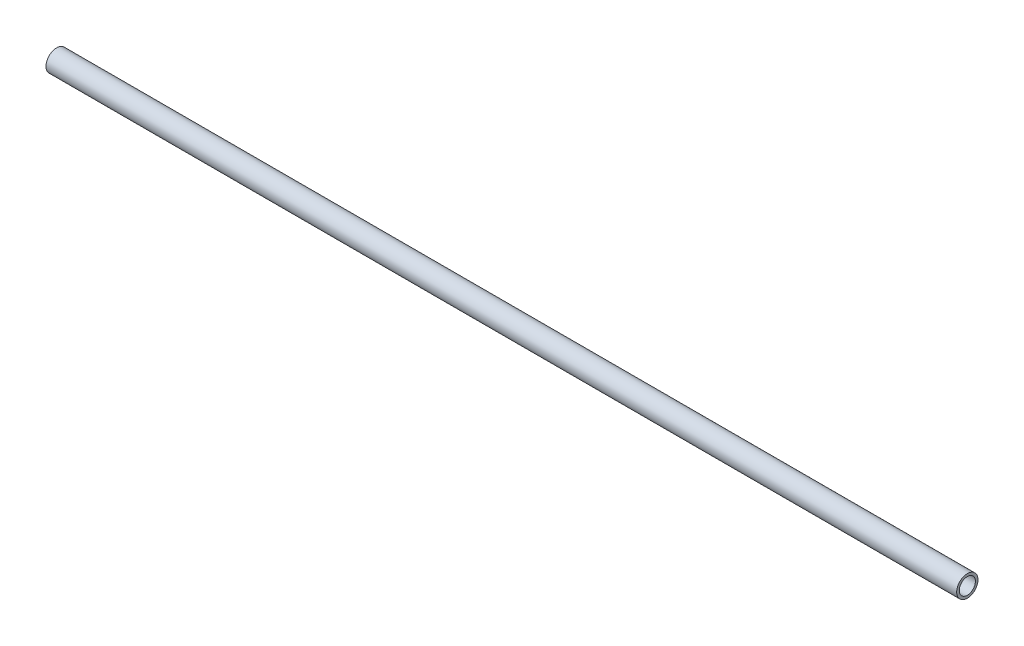
from build123d import *

# Parameters (mm, degrees)
SKETCH1_R           = 1.0541
SKETCH1_R_2         = 0.8001
BOSS_EXTRUDE1_DEPTH = 90
CUT_EXTRUDE2_DEPTH  = 10


with BuildPart() as part:
    # Sketch1 → Boss-Extrude1 (new body)
    with BuildSketch(Plane(origin=(0, 0, 0), x_dir=(0, 0, -1), z_dir=(1, 0, 0))):
        with Locations(Location((0, 0, 0), (0, 0, 180))):
            Circle(SKETCH1_R)
        with Locations(Location((0, 0, 0), (0, 0, 180))):
            Circle(SKETCH1_R_2, mode=Mode.SUBTRACT)
    extrude(amount=BOSS_EXTRUDE1_DEPTH)

    # Sketch3 → Cut-Extrude2 (cut)
    with BuildSketch(Plane.XY):
        with BuildLine():
            Line((1.079657865, 0.79375), (4.229657865, 0.79375))
            ThreePointArc((4.229657865, 0.79375), (5.023407865, 0), (4.229657865, -0.79375))
            Line((4.229657865, -0.79375), (1.079657865, -0.79375))
            ThreePointArc((1.079657865, -0.79375), (0.285907865, 0), (1.079657865, 0.79375))
        make_face()
    extrude(amount=-CUT_EXTRUDE2_DEPTH, mode=Mode.SUBTRACT)


solid = part.part
